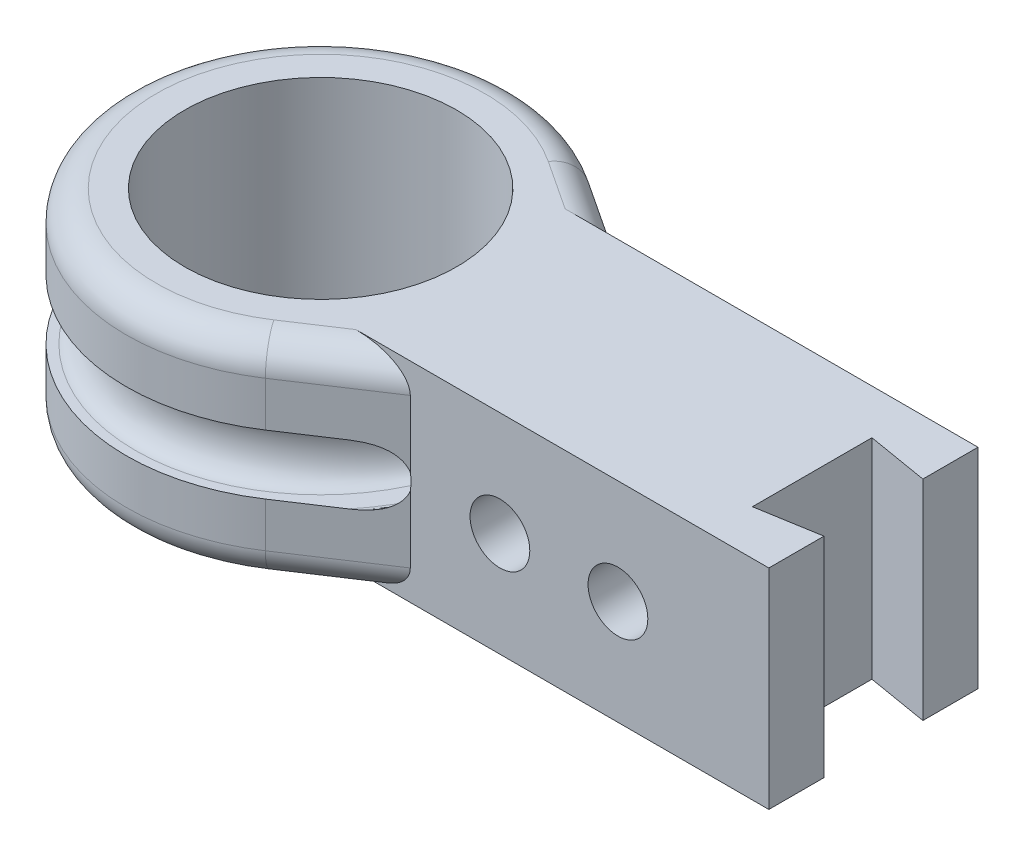
from build123d import *

# Parameters (mm, degrees)
SKETCH1_R           = 4.55
BOSS_EXTRUDE2_DEPTH = 7
CUT_EXTRUDE1_REACH  = 24.164
SKETCH3_R           = 1
FILLET4_R           = 1


with BuildPart() as part:
    # Sketch1 → Boss-Extrude2 (new body)
    with BuildSketch(Plane(origin=(0, 0, 0), x_dir=(1, 0, 0), z_dir=(0, 1, 0))):
        with BuildLine():
            Line((6.5, 3.5), (3.577981651, 5.426605505))
            ThreePointArc((3.577981651, 5.426605505), (-6.5, 0), (3.577981651, -5.426605505))
            Line((3.577981651, -5.426605505), (6.5, -3.5))
            Line((6.5, -3.5), (18.5, -3.5))
            Line((18.5, -3.5), (18.5, -1.655))
            Line((18.5, -1.655), (16.45, -2))
            Line((16.45, -2), (16.45, 2))
            Line((16.45, 2), (18.5, 1.655))
            Line((18.5, 1.655), (18.5, 3.5))
            Line((18.5, 3.5), (6.5, 3.5))
        make_face()
        with Locations(Location((0, 0, 0), (0, 0, 270))):
            Circle(SKETCH1_R, mode=Mode.SUBTRACT)
    extrude(amount=BOSS_EXTRUDE2_DEPTH)

    # Sketch2 → Cut-Revolve1 (revolve, cut)
    with BuildSketch(Plane(origin=(0, 0, 0), x_dir=(0, -1, 0), z_dir=(1, 0, 0))):
        with BuildLine():
            Line((-4.5, 6.805), (-4.5, 6.195))
            add(Edge.make_bspline(
                [(-4.5, 6.195), (-4.5, 5.595), (-3.5, 5.595), (-2.5, 5.595), (-2.5, 6.195)],
                knots=[0, 0, 0, 1.570796327, 1.570796327, 3.141592654, 3.141592654, 3.141592654], degree=2, weights=[1, 0.707106781, 1, 0.707106781, 1]))
            Line((-2.5, 6.195), (-2.5, 6.805))
            add(Edge.make_bspline(
                [(-2.5, 6.805), (-2.499999858, 7.405000085), (-3.5, 7.405000085), (-4.500000142, 7.405000085), (-4.5, 6.805)],
                knots=[3.141592512, 3.141592512, 3.141592512, 4.71238898, 4.71238898, 6.283185449, 6.283185449, 6.283185449], degree=2, weights=[1, 0.707106731, 1, 0.707106731, 1]))
        make_face()
    revolve(axis=Axis((0, 7.335318457, 0), (0, -1, 0)), mode=Mode.SUBTRACT)

    # Sketch3 → Cut-Extrude1 (cut, up to next)
    with BuildSketch(Plane.XY.offset(3.5), mode=Mode.PRIVATE) as cut_extrude1_sk1:
        with Locations((13.45, 3.5)):
            Circle(SKETCH3_R)
    cut_extrude1_tool1 = extrude(cut_extrude1_sk1.sketch, amount=-CUT_EXTRUDE1_REACH, mode=Mode.PRIVATE) & part.part
    # Sketch3 → Cut-Extrude1 (cut, up to next)
    with BuildSketch(Plane.XY.offset(3.5), mode=Mode.PRIVATE) as cut_extrude1_sk2:
        with Locations((9.5, 3.5)):
            Circle(SKETCH3_R)
    cut_extrude1_tool2 = extrude(cut_extrude1_sk2.sketch, amount=-CUT_EXTRUDE1_REACH, mode=Mode.PRIVATE) & part.part
    add(cut_extrude1_tool1.solids().sort_by_distance((13.45, 3.5, 3.5))[0], mode=Mode.SUBTRACT)
    add(cut_extrude1_tool2.solids().sort_by_distance((9.5, 3.5, 3.5))[0], mode=Mode.SUBTRACT)

    # Fillet4
    fillet4_edges = [part.edges().sort_by_distance(p)[0] for p in [
        (5.038990826, 7, -4.463302752),
        (5.038990826, 0, -4.463302752),
        (-6.5, 0, 0),
        (5.038990826, 0, 4.463302752),
        (5.038990826, 7, 4.463302752),
        (-6.5, 7, 0),
    ]]
    fillet(fillet4_edges, radius=FILLET4_R)


solid = part.part
